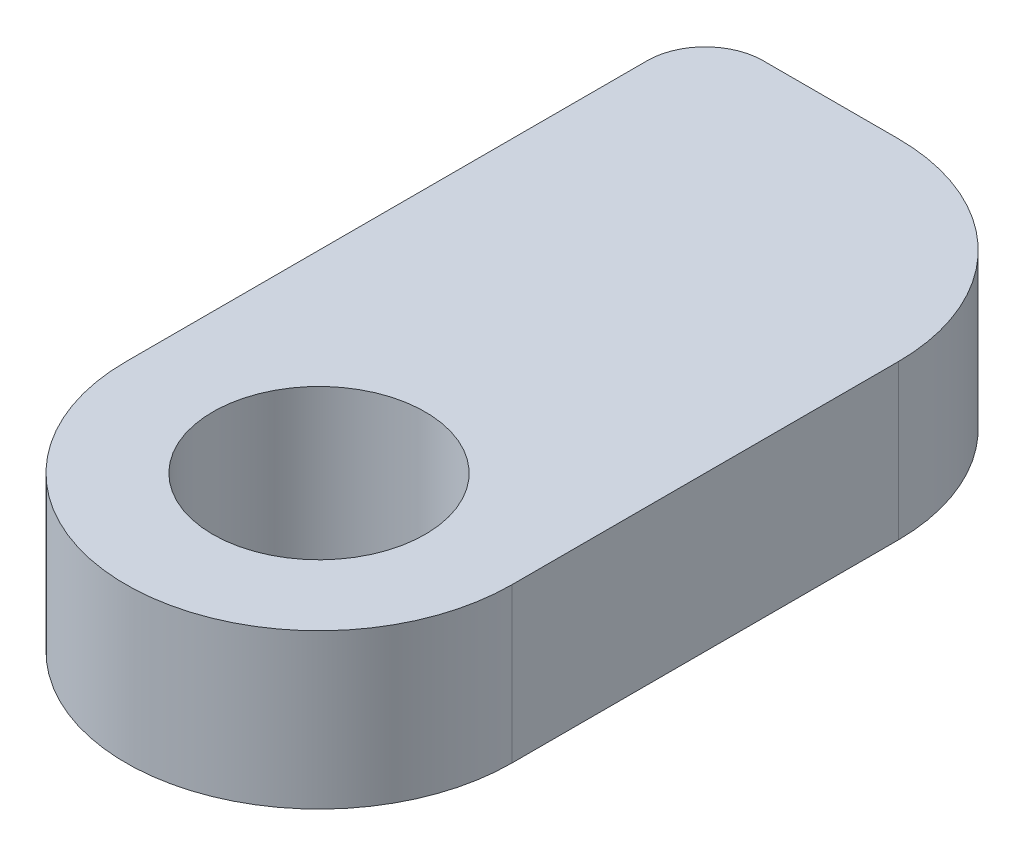
from build123d import *

# Parameters (mm, degrees)
SKETCH1_W           = 20
SKETCH1_H           = 40
SKETCH1_R           = 5.5
BOSS_EXTRUDE1_DEPTH = 8
FILLET1_RADIUS      = 10
FILLET1_LENGTH      = 8
FILLET2_R           = 10
FILLET3_R           = 3


with BuildPart() as part:
    # Sketch1 → Boss-Extrude1 (new body)
    with BuildSketch(Plane(origin=(0, 0, 0), x_dir=(1, 0, 0), z_dir=(0, 1, 0))):
        Rectangle(SKETCH1_W, SKETCH1_H)
        with Locations(Location((0, -10, 0), (0, 0, 270))):
            Circle(SKETCH1_R, mode=Mode.SUBTRACT)
    extrude(amount=BOSS_EXTRUDE1_DEPTH)

    # Fillet1: full round fillet: the end face becomes a half cylinder, R = half its width
    fillet1_face = Plane((0, 4, 20), x_dir=(0, 1, 0), z_dir=(0, 0, 1))  # on the end face: x along it, z out of the body
    fillet1_slab = fillet1_face.offset(-FILLET1_RADIUS / 2) * Box(FILLET1_LENGTH, 2 * FILLET1_RADIUS, FILLET1_RADIUS, mode=Mode.PRIVATE)  # the body's end, R deep
    fillet1_round = Plane((0, 4, 10), x_dir=(0, 0, 1), z_dir=(0, 1, 0)) * Cylinder(FILLET1_RADIUS, FILLET1_LENGTH, mode=Mode.PRIVATE)  # its axis R under the face
    add(fillet1_slab - fillet1_round, mode=Mode.SUBTRACT)

    # Fillet2
    fillet2_edges = [part.edges().sort_by_distance(p)[0] for p in [
        (10, 4, -20),
    ]]
    fillet(fillet2_edges, radius=FILLET2_R)

    # Fillet3
    fillet3_edges = [part.edges().sort_by_distance(p)[0] for p in [
        (-10, 4, -20),
    ]]
    fillet(fillet3_edges, radius=FILLET3_R)


solid = part.part
